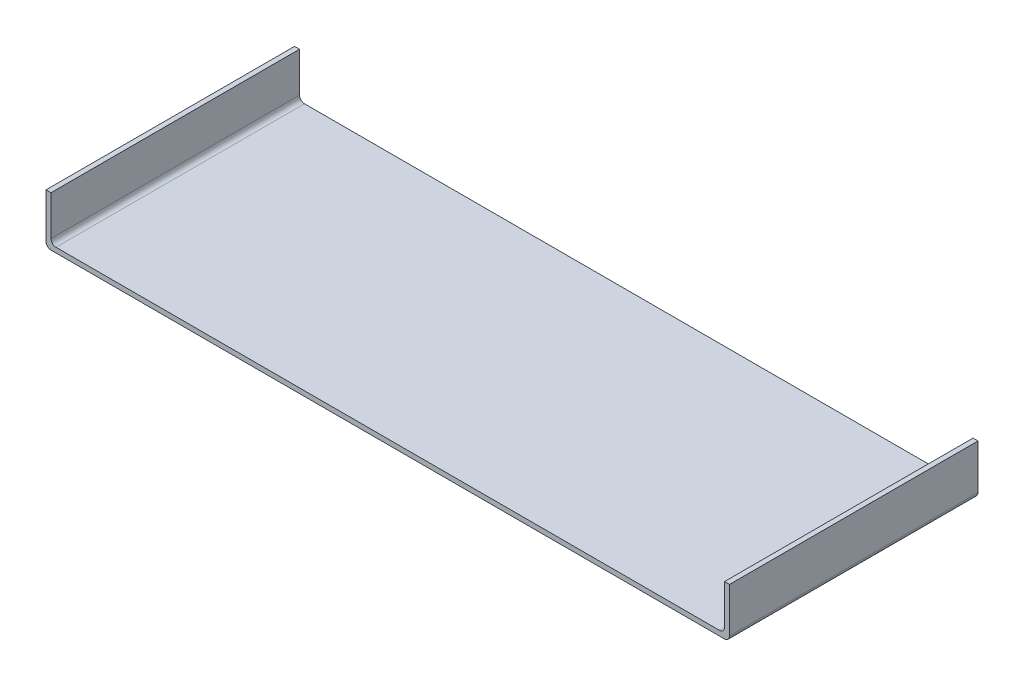
from build123d import *

# Parameters (mm, degrees)
SKETCH1_W           = 275
SKETCH1_H           = 100
BOSS_EXTRUDE1_DEPTH = 20
SHELL2_T            = -2
FILLET1_R           = 2


with BuildPart() as part:
    # Sketch1 → Boss-Extrude1 (new body)
    with BuildSketch(Plane(origin=(0, 0, 0), x_dir=(1, 0, 0), z_dir=(0, 1, 0))):
        with Locations((-137.5, 50)):
            Rectangle(SKETCH1_W, SKETCH1_H)
    extrude(amount=BOSS_EXTRUDE1_DEPTH)

    # Shell2
    shell2_openings = [part.faces().sort_by_distance(p)[0] for p in [
        (-137.5, 20, -50),
        (-137.5, 10, 0),
        (-137.5, 10, -100),
    ]]
    offset(amount=SHELL2_T, openings=shell2_openings, kind=Kind.INTERSECTION)

    # Fillet1
    fillet1_edges = [part.edges().sort_by_distance(p)[0] for p in [
        (-2, 2, -50),
        (-273, 2, -50),
        (-275, 0, -50),
        (0, 0, -50),
    ]]
    fillet(fillet1_edges, radius=FILLET1_R)


solid = part.part
